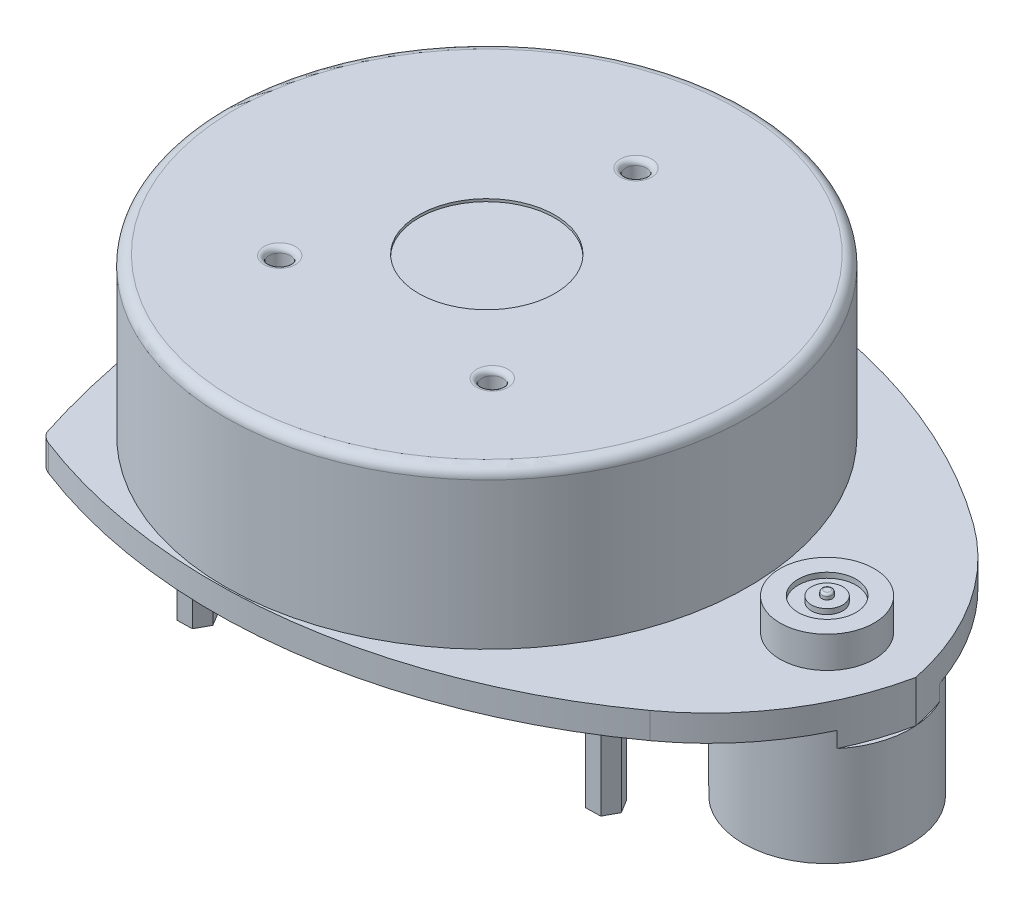
from build123d import *

# Parameters (mm, degrees)
SKETCH_1_W          = 130
SKETCH_1_H          = 110
EXTRUDE_1_DEPTH     = 5
SKETCH_2_R          = 50
EXTRUDE_2_DEPTH     = 30
SKETCH_3_R          = 2
CUT_EXTRUDE_1_DEPTH = 5
FILLET_1_R          = 2
FILLET_2_R          = 1
SKETCH_4_R          = 13
CUT_EXTRUDE_3_DEPTH = 0.5
SKETCH_5_R          = 1.25
CUT_EXTRUDE_4_DEPTH = 5
SKETCH_6_R          = 9
EXTRUDE_3_DEPTH     = 7
CUT_EXTRUDE_START   = -1
SKETCH_7_R          = 9
SKETCH_7_R_2        = 0.99350654
CUT_EXTRUDE_5_DEPTH = 1
SKETCH_8_R          = 5.521677929
SKETCH_8_R_2        = 3.001097475
CUT_EXTRUDE_6_DEPTH = 1
FILLET_3_R          = 0.4
SKETCH_9_R          = 16
EXTRUDE_4_DEPTH     = 27
EXTRUDE_5_DEPTH     = 24.6
SKETCH_11_R         = 26
EXTRUDE_6_DEPTH     = 8
FILLET_4_R          = 1
CUT_EXTRUDE_7_DEPTH = 8
L_EK1_SCALE         = 0.05


with BuildPart() as part:
    # Эскиз1 → Бобышка-Вытянуть1 (new body)
    with BuildSketch(Plane(origin=(0, 0, 0), x_dir=(1, 0, 0), z_dir=(0, 1, 0))):
        Rectangle(SKETCH_1_W, SKETCH_1_H)
    extrude(amount=EXTRUDE_1_DEPTH)

    # Эскиз2 → Бобышка-Вытянуть2 (add)
    with BuildSketch(Plane(origin=(0, 5, 0), x_dir=(1, 0, 0), z_dir=(0, 1, 0))):
        with Locations(Location((-15, 0, 0), (0, 0, 180))):
            Circle(SKETCH_2_R)
    extrude(amount=EXTRUDE_2_DEPTH)

    # Эскиз3 → Вырез-Вытянуть1 (cut)
    with BuildSketch(Plane(origin=(0, 35, 0), x_dir=(1, 0, 0), z_dir=(0, 1, 0))):
        with Locations(Location((-15, 28.5, 0), (0, 0, 270))):
            Circle(SKETCH_3_R)
        with Locations(Location((-34.553940504, -20, 0), (0, 0, 270))):
            Circle(SKETCH_3_R)
        with Locations(Location((6.053940504, -20, 0), (0, 0, 270))):
            Circle(SKETCH_3_R)
    extrude(amount=-CUT_EXTRUDE_1_DEPTH, mode=Mode.SUBTRACT)

    # Скругление1
    fillet_1_edges = [part.edges().sort_by_distance(p)[0] for p in [
        (35, 35, 0),
    ]]
    fillet(fillet_1_edges, radius=FILLET_1_R)

    # Скругление2
    fillet_2_edges = [part.edges().sort_by_distance(p)[0] for p in [
        (-15, 35, -30.5),
        (-34.553940504, 35, 18),
        (6.053940504, 35, 18),
    ]]
    fillet(fillet_2_edges, radius=FILLET_2_R)

    # Эскиз4 → Вырез-Вытянуть3 (cut)
    with BuildSketch(Plane(origin=(0, 35, 0), x_dir=(1, 0, 0), z_dir=(0, 1, 0))):
        with Locations(Location((-15, 0, 0), (0, 0, 270))):
            Circle(SKETCH_4_R)
    extrude(amount=-CUT_EXTRUDE_3_DEPTH, mode=Mode.SUBTRACT)

    # Эскиз5 → Вырез-Вытянуть4 (cut)
    with BuildSketch(Plane(origin=(0, 5, 0), x_dir=(1, 0, 0), z_dir=(0, 1, 0))):
        with Locations(Location((-42.261625838, 28, 0), (0, 0, 270))):
            Circle(SKETCH_5_R)
        with Locations(Location((27.738374162, 20, 0), (0, 0, 270))):
            Circle(SKETCH_5_R)
        with Locations(Location((27.738374162, -20, 0), (0, 0, 90))):
            Circle(SKETCH_5_R)
        with Locations(Location((-42.261625838, -28, 0), (0, 0, 90))):
            Circle(SKETCH_5_R)
    extrude(amount=-CUT_EXTRUDE_4_DEPTH, mode=Mode.SUBTRACT)

    # Эскиз6 → Бобышка-Вытянуть3 (add)
    with BuildSketch(Plane(origin=(0, 5, 0), x_dir=(1, 0, 0), z_dir=(0, 1, 0))):
        with Locations(Location((50, 0, 0), (0, 0, 270))):
            Circle(SKETCH_6_R)
    extrude(amount=EXTRUDE_3_DEPTH)

    # Эскиз7 → Вырез-Вытянуть5 (cut)
    with BuildSketch(Plane(origin=(0, 12, 0), x_dir=(1, 0, 0), z_dir=(0, 1, 0)).offset(CUT_EXTRUDE_START)):
        with Locations(Location((50, 0, 0), (0, 0, 270))):
            Circle(SKETCH_7_R)
        with Locations(Location((50, 0, 0), (0, 0, 270))):
            Circle(SKETCH_7_R_2, mode=Mode.SUBTRACT)
    extrude(amount=CUT_EXTRUDE_5_DEPTH, mode=Mode.SUBTRACT)

    # Эскиз8 → Вырез-Вытянуть6 (cut)
    with BuildSketch(Plane(origin=(0, 11, 0), x_dir=(1, 0, 0), z_dir=(0, 1, 0))):
        with Locations(Location((50, 0, 0), (0, 0, 270))):
            Circle(SKETCH_8_R)
        with Locations(Location((50, 0, 0), (0, 0, 270))):
            Circle(SKETCH_8_R_2, mode=Mode.SUBTRACT)
    extrude(amount=-CUT_EXTRUDE_6_DEPTH, mode=Mode.SUBTRACT)

    # Скругление3
    fillet_3_edges = [part.edges().sort_by_distance(p)[0] for p in [
        (50, 12, -0.99350654),
    ]]
    fillet(fillet_3_edges, radius=FILLET_3_R)

    # Эскиз9 → Бобышка-Вытянуть4 (add)
    with BuildSketch(Plane(origin=(0, 5, 0), x_dir=(1, 0, 0), z_dir=(0, 1, 0))):
        with Locations(Location((50, 0, 0), (0, 0, 270))):
            Circle(SKETCH_9_R)
    extrude(amount=-EXTRUDE_4_DEPTH)

    # Эскиз10 → Бобышка-Вытянуть5 (add)
    with BuildSketch(Plane.XZ):
        Polygon((-40.866240746, 25.472900125), (-39.375400602, 27.944889), (-40.770785694, 30.471988875), (-43.65701093, 30.527099875), (-45.147851074, 28.055111), (-43.752465982, 25.528011125), align=None)
        Polygon((29.24550787, 22.462088812), (26.359709559, 22.536260484), (24.85257585, 20.074171672), (26.231240454, 17.537911188), (29.117038766, 17.463739516), (30.624172474, 19.925828328), align=None)
        Polygon((30.624172474, -19.925828328), (29.24550787, -22.462088812), (26.359709559, -22.536260484), (24.85257585, -20.074171672), (26.231240454, -17.537911188), (29.117038766, -17.463739516), align=None)
        Polygon((-43.752465982, -25.528011125), (-40.866240746, -25.472900125), (-39.375400602, -27.944889), (-40.770785694, -30.471988875), (-43.65701093, -30.527099875), (-45.147851074, -28.055111), align=None)
    extrude(amount=EXTRUDE_5_DEPTH)

    # Эскиз11 → Бобышка-Вытянуть6 (add)
    with BuildSketch(Plane(origin=(0, 5, 0), x_dir=(1, 0, 0), z_dir=(0, 1, 0))):
        with Locations(Location((-15, 0, 0), (0, 0, 270))):
            Circle(SKETCH_11_R)
    extrude(amount=-EXTRUDE_6_DEPTH)

    # Скругление4
    fillet_4_edges = [part.edges().sort_by_distance(p)[0] for p in [
        (-15, -3, -26),
    ]]
    fillet(fillet_4_edges, radius=FILLET_4_R)

    # Эскиз12 → Вырез-Вытянуть7 (cut)
    with BuildSketch(Plane(origin=(0, 5, 0), x_dir=(1, 0, 0), z_dir=(0, 1, 0))):
        with BuildLine():
            ThreePointArc((-55.61952989, 45.088026087), (-3.110505258, 51.413291648), (46.042054033, 31.888113866))
            Line((46.042054033, 31.888113866), (50.155519467, 31.888113866))
            Line((50.155519467, 31.888113866), (50.155519467, 28.566762229))
            ThreePointArc((50.155519467, 28.566762229), (60.276568777, 16.053661962), (65.968719423, 1))
            ThreePointArc((65.968719423, 1), (65.651885301, 3.319410567), (65, 5.567764363))
            Line((65, 5.567764363), (65, 55))
            Line((65, 55), (-65, 55))
            Line((-65, 55), (-65, 1))
            ThreePointArc((-65, 1), (-62.771083165, 22.512212182), (-57.554193562, 43.500956931))
            ThreePointArc((-57.554193562, 43.500956931), (-56.714161483, 44.449672028), (-55.61952989, 45.088026087))
        make_face()
        with BuildLine():
            ThreePointArc((65.968719423, 1), (60.276568777, -14.053661962), (50.155519467, -26.566762229))
            Line((50.155519467, -26.566762229), (50.155519467, -35.927423649))
            Line((50.155519467, -35.927423649), (36.730685776, -35.927423649))
            ThreePointArc((36.730685776, -35.927423649), (-8.632007519, -49.985426777), (-55.61952989, -43.088026087))
            ThreePointArc((-55.61952989, -43.088026087), (-56.714161483, -42.449672028), (-57.554193562, -41.500956931))
            ThreePointArc((-57.554193562, -41.500956931), (-62.064422103, -24.270987895), (-64.557696698, -6.635864526))
            ThreePointArc((-64.557696698, -6.635864526), (-64.889301633, -3.325294356), (-65, 0))
            Line((-65, 0), (-65, -55))
            Line((-65, -55), (65, -55))
            Line((65, -55), (65, -5.567764363))
            ThreePointArc((65, -5.567764363), (65.828748461, -2.334678168), (65.968719423, 1))
        make_face()
        with BuildLine():
            Line((50.155519467, -35.927423649), (50.155519467, -26.566762229))
            ThreePointArc((50.155519467, -26.566762229), (48.142085096, -28.281062677), (46.042054033, -29.888113866))
            ThreePointArc((46.042054033, -29.888113866), (41.464500793, -33.028230448), (36.730685776, -35.927423649))
            Line((36.730685776, -35.927423649), (50.155519467, -35.927423649))
        make_face()
        with BuildLine():
            Line((50.155519467, 31.888113866), (46.042054033, 31.888113866))
            ThreePointArc((46.042054033, 31.888113866), (48.142085096, 30.281062677), (50.155519467, 28.566762229))
            Line((50.155519467, 28.566762229), (50.155519467, 31.888113866))
        make_face()
    extrude(amount=-CUT_EXTRUDE_7_DEPTH, mode=Mode.SUBTRACT)


with BuildPart() as part_1:
    # Ölçek1: scaled about (-9.386888291, 14.55303931, -0.17309767)
    add(part.part.scale(L_EK1_SCALE).moved(Location((-8.917543876, 13.825387344, -0.164442786))))


solid = part_1.part
